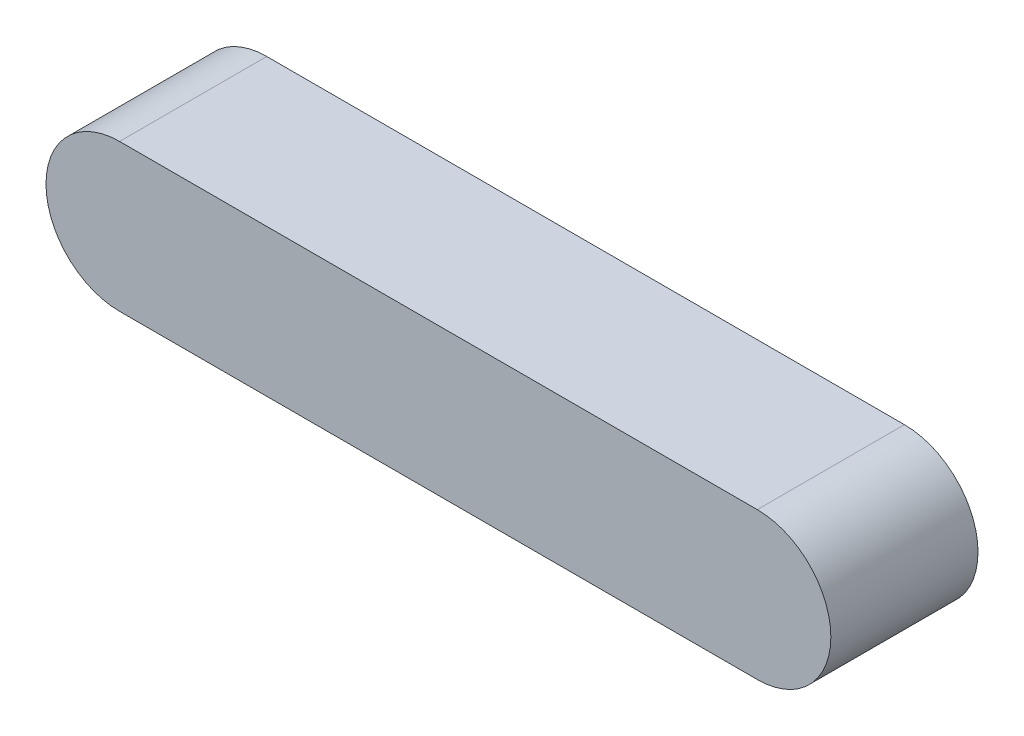
from build123d import *

# Parameters (mm, degrees)
EXTRUSION1_DEPTH = 6


with BuildPart() as part:
    # Esquisse1 → Extrusion1 (new body)
    with BuildSketch(Plane.XY):
        with BuildLine():
            Line((0, 0), (26, 0))
            ThreePointArc((26, 0), (29, -3), (26, -6))
            Line((26, -6), (0, -6))
            ThreePointArc((0, -6), (-3, -3), (0, 0))
        make_face()
    extrude(amount=EXTRUSION1_DEPTH)


solid = part.part
